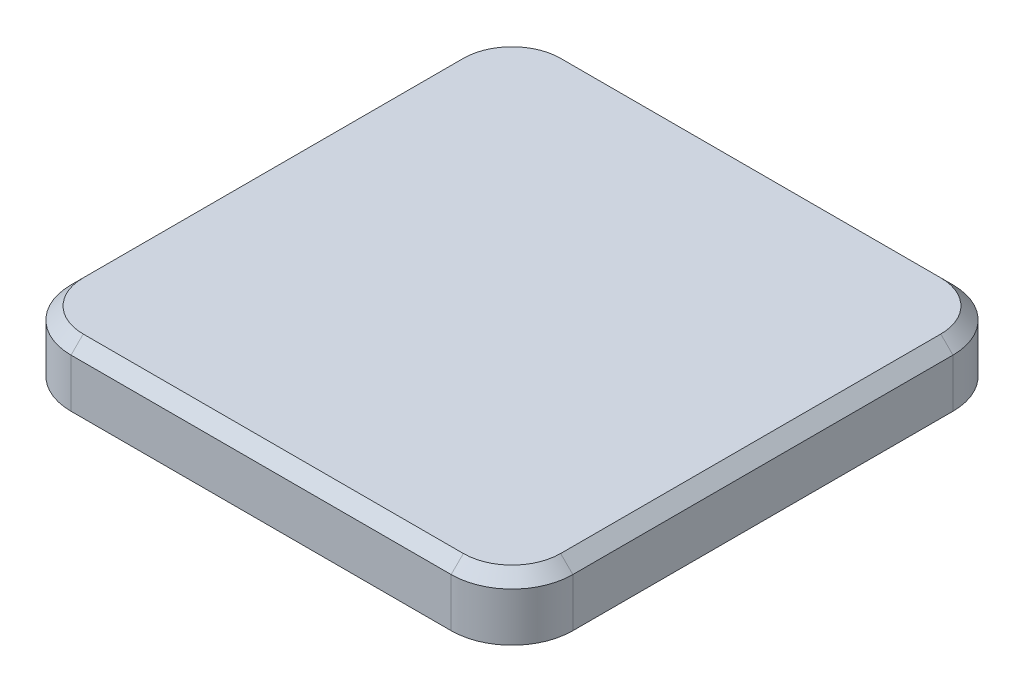
from build123d import *

# Parameters (mm, degrees)
ESQUISSE1_W             = 16.5
ESQUISSE1_H             = 16.5
BOSS_EXTRU_1_DEPTH      = 2
BOSS_EXTRU_2_DEPTH      = 3
BOSS_EXTRU_2_TAPER      = 2
SYM_TRIE2_COPY_1_DEPTH  = 3
SYM_TRIE2_COPY_1_TAPER  = 2
CONG_1_R                = 2
CHANFREIN1_SIZE         = 0.4
ENL_V_MAT_EXTRU_1_DEPTH = 1.6


with BuildPart() as part:
    # Esquisse1 → Boss.-Extru.1 (new body)
    with BuildSketch(Plane(origin=(0, 0, 0), x_dir=(1, 0, 0), z_dir=(0, 1, 0))):
        Rectangle(ESQUISSE1_W, ESQUISSE1_H)
    extrude(amount=BOSS_EXTRU_1_DEPTH)

    # Esquisse2 → Boss.-Extru.2 (add)
    with BuildSketch(Plane.XZ):
        Polygon((-2.35, -0.475899827), (-2.35, 0.5), (-2.25, 0.5), (-2.25, 1.45), (-3.45, 1.45), (-3.45, 0.5), (-3.35, 0.5), (-3.35, -0.475899827), align=None)
    boss_extru_2 = extrude(amount=BOSS_EXTRU_2_DEPTH, taper=BOSS_EXTRU_2_TAPER)

    # Symétrie1: Boss.-Extru.2 across plane
    add(boss_extru_2.mirror(Plane.XY))

    # Symétrie2: Boss.-Extru.2 across plane
    add(boss_extru_2.mirror(Plane(origin=(0, 0, 0), x_dir=(0, 0, 1), z_dir=(1, 0, 0))))

    # Symétrie2 copy 1 sketch → Symétrie2 copy 1 (add)
    with BuildSketch(Plane(origin=(0, 0, 0), x_dir=(-1, 0, 0), z_dir=(0, -1, 0))):
        Polygon((-2.35, -0.475899827), (-2.35, 0.5), (-2.25, 0.5), (-2.25, 1.45), (-3.45, 1.45), (-3.45, 0.5), (-3.35, 0.5), (-3.35, -0.475899827), align=None)
    extrude(amount=SYM_TRIE2_COPY_1_DEPTH, taper=SYM_TRIE2_COPY_1_TAPER)

    # Congé1
    cong_1_edges = [part.edges().sort_by_distance(p)[0] for p in [
        (8.25, 1, 8.25),
        (-8.25, 1, 8.25),
        (-8.25, 1, -8.25),
        (8.25, 1, -8.25),
    ]]
    fillet(cong_1_edges, radius=CONG_1_R)

    # Chanfrein1
    chanfrein1_edges = [part.edges().sort_by_distance(p)[0] for p in [
        (0, 2, -8.25),
        (8.25, 2, 0),
        (-8.25, 2, 0),
        (0, 2, 8.25),
        (-7.664213562, 2, -7.664213562),
        (-7.664213562, 2, 7.664213562),
        (7.664213562, 2, 7.664213562),
        (7.664213562, 2, -7.664213562),
    ]]
    chamfer(chanfrein1_edges, length=CHANFREIN1_SIZE)

    # Esquisse3 → Enlèv. mat.-Extru.1 (cut)
    with BuildSketch(Plane.XZ):
        with BuildLine():
            Line((-1.575, -3.984277344), (-1.575, -3.336914062))
            add(Edge.make_bspline(
                [(-1.575, -3.336914062), (-1.574847832, -3.316392728), (-1.57455992, -3.27756503), (-1.569515207, -3.222565664), (-1.562537162, -3.173985634), (-1.551552538, -3.130998772), (-1.535902623, -3.092325652), (-1.516369987, -3.055832071), (-1.490289613, -3.021967501), (-1.447671651, -2.977887357), (-1.38099065, -2.925629124), (-1.321165156, -2.890253802), (-1.289257813, -2.871386719)],
                knots=[0, 0, 0, 0, 1.051368922, 1.989258278, 2.828359627, 3.564877372, 4.256703728, 4.962292808, 5.679386817, 6.439329514, 8.100951115, 10, 10, 10, 10], degree=3))
            add(Edge.make_bspline(
                [(-1.289257813, -2.871386719), (-1.238731723, -2.845268712), (-1.139605512, -2.794028273), (-0.98915298, -2.728904714), (-0.842017487, -2.673504732), (-0.695860366, -2.629746127), (-0.547782053, -2.596823717), (-0.395107181, -2.572631678), (-0.236085851, -2.559128901), (-0.128084275, -2.557220694), (-0.073144531, -2.55625)],
                knots=[0, 0, 0, 0, 1.074357563, 2.107762432, 3.095394097, 4.043430564, 4.987646856, 5.959471913, 6.961995795, 8, 8, 8, 8], degree=3))
            add(Edge.make_bspline(
                [(-0.073144531, -2.55625), (-0.009272899, -2.557636822), (0.116147249, -2.560360024), (0.299842066, -2.583466715), (0.475007756, -2.620685667), (0.640574117, -2.673588435), (0.796577717, -2.739392847), (0.940554455, -2.82075864), (1.073827814, -2.914410786), (1.193481806, -3.0232777), (1.301327448, -3.14373867), (1.395802068, -3.276972558), (1.476263168, -3.422577787), (1.544188637, -3.579501644), (1.597333733, -3.747409496), (1.635546192, -3.92520751), (1.658377561, -4.112651429), (1.661106079, -4.24078848), (1.6625, -4.30625)],
                knots=[0, 0, 0, 0, 1.1004527, 2.160880131, 3.1853343, 4.18265483, 5.152098474, 6.09807923, 7.027563981, 7.953482777, 8.879701341, 9.809186092, 10.762021988, 11.741783193, 12.751521339, 13.792159158, 14.872077861, 16, 16, 16, 16], degree=3))
            add(Edge.make_bspline(
                [(1.6625, -4.30625), (1.661062633, -4.370799091), (1.658245372, -4.497316343), (1.635890735, -4.683054176), (1.599341105, -4.860449347), (1.54757035, -5.028799263), (1.481150245, -5.186590958), (1.401280818, -5.332904839), (1.30693145, -5.46675119), (1.198464788, -5.5874976), (1.076749384, -5.694928795), (0.943265318, -5.790576855), (0.79605987, -5.870541582), (0.637635702, -5.939111113), (0.466836983, -5.99089966), (0.285359857, -6.029555035), (0.092627918, -6.052124312), (-0.039589232, -6.054852399), (-0.107324219, -6.05625)],
                knots=[0, 0, 0, 0, 1.098577174, 2.153228837, 3.179485586, 4.178212777, 5.146472136, 6.089133441, 7.01037838, 7.92781811, 8.845569396, 9.769057348, 10.716987226, 11.691851712, 12.702842318, 13.749675381, 14.847156307, 16, 16, 16, 16], degree=3))
            add(Edge.make_bspline(
                [(-0.107324219, -6.05625), (-0.162740867, -6.055307935), (-0.270663272, -6.05347329), (-0.427758488, -6.036130678), (-0.575257815, -6.007609407), (-0.712469531, -5.968232536), (-0.837889293, -5.919307337), (-0.952034473, -5.865938991), (-1.053469006, -5.805422169), (-1.142443486, -5.739029567), (-1.219898735, -5.668542457), (-1.286253316, -5.595308782), (-1.344894799, -5.521900738), (-1.390556658, -5.445433551), (-1.426875382, -5.370772902), (-1.453051247, -5.29959708), (-1.47016033, -5.232633722), (-1.472641628, -5.189085454), (-1.473828125, -5.168261719)],
                knots=[0, 0, 0, 0, 1.493526304, 2.908601609, 4.254282934, 5.539376775, 6.750893542, 7.880196463, 8.932637134, 9.929013795, 10.868250492, 11.750880765, 12.591354794, 13.396234964, 14.14629432, 14.82646297, 15.438842792, 16, 16, 16, 16], degree=3))
            add(Edge.make_bspline(
                [(-1.473828125, -5.168261719), (-1.472587377, -5.147412049), (-1.470157478, -5.106579734), (-1.452620603, -5.047596536), (-1.422328102, -4.994058884), (-1.381436264, -4.946759035), (-1.332614869, -4.90721984), (-1.277949295, -4.878026082), (-1.218151753, -4.859924208), (-1.176594009, -4.858141271), (-1.155273438, -4.857226563)],
                knots=[0, 0, 0, 0, 1.011347772, 1.98063909, 2.956031586, 3.97569046, 4.998224318, 5.987747808, 6.967644449, 8, 8, 8, 8], degree=3))
            add(Edge.make_bspline(
                [(-1.155273438, -4.857226563), (-1.131289132, -4.85890009), (-1.082955403, -4.862272622), (-1.015026719, -4.891164211), (-0.951991459, -4.931816634), (-0.920343402, -4.970854445), (-0.904394531, -4.990527344)],
                knots=[0, 0, 0, 0, 0.974082092, 1.962992855, 2.973461023, 4, 4, 4, 4], degree=3))
            add(Edge.make_bspline(
                [(-0.904394531, -4.990527344), (-0.884116918, -5.021899027), (-0.845992584, -5.080881538), (-0.788684033, -5.161897896), (-0.737322236, -5.231242973), (-0.689753628, -5.291022988), (-0.639431466, -5.341329009), (-0.58328082, -5.386253896), (-0.519470834, -5.426948968), (-0.4480701, -5.464709135), (-0.366794074, -5.494634077), (-0.275544199, -5.516451851), (-0.173999009, -5.529297297), (-0.102805503, -5.530580075), (-0.065625, -5.53125)],
                knots=[0, 0, 0, 0, 1.269947272, 2.387652494, 3.37313563, 4.204428757, 4.982345797, 5.786964542, 6.644417406, 7.552294032, 8.527983303, 9.580271219, 10.73630703, 12, 12, 12, 12], degree=3))
            add(Edge.make_bspline(
                [(-0.065625, -5.53125), (-0.02661868, -5.530110629), (0.049639447, -5.527883135), (0.160899679, -5.513105852), (0.265420194, -5.486686174), (0.363828072, -5.45147555), (0.455244924, -5.405282194), (0.53974101, -5.349592426), (0.617406976, -5.284887154), (0.688434076, -5.211398491), (0.751312195, -5.128076186), (0.806782554, -5.036234517), (0.854175941, -4.935362919), (0.893379303, -4.826129071), (0.925061924, -4.709388867), (0.946108446, -4.585973475), (0.960713876, -4.456762802), (0.961895439, -4.368500383), (0.9625, -4.323339844)],
                knots=[0, 0, 0, 0, 1.044410732, 2.041843643, 2.997734968, 3.926068631, 4.83464545, 5.733170603, 6.629933431, 7.536048868, 8.463419736, 9.418707305, 10.40391836, 11.442234805, 12.522592864, 13.637990383, 14.791449055, 16, 16, 16, 16], degree=3))
            add(Edge.make_bspline(
                [(0.9625, -4.323339844), (0.961801211, -4.275003267), (0.960440484, -4.18087917), (0.947358426, -4.044002287), (0.925573834, -3.915835559), (0.895763361, -3.796078936), (0.856795995, -3.685101046), (0.809536801, -3.582345542), (0.753493274, -3.488109518), (0.688115615, -3.40319437), (0.615780369, -3.326963), (0.535926289, -3.260853419), (0.449191479, -3.205028262), (0.355378121, -3.15986487), (0.255266351, -3.12417699), (0.148233458, -3.0989371), (0.034396363, -3.083676281), (-0.043929082, -3.082072279), (-0.084082031, -3.08125)],
                knots=[0, 0, 0, 0, 1.258228293, 2.450103211, 3.575637537, 4.640414304, 5.659261833, 6.633411695, 7.580652055, 8.50738272, 9.417945118, 10.311239573, 11.199892376, 12.096725889, 13.01619305, 13.961592355, 14.955025684, 16, 16, 16, 16], degree=3))
            add(Edge.make_bspline(
                [(-0.084082031, -3.08125), (-0.123534552, -3.082049073), (-0.201245111, -3.083623025), (-0.316097263, -3.0957804), (-0.427527103, -3.114306818), (-0.535742852, -3.142506903), (-0.64230754, -3.176826185), (-0.748709463, -3.218325548), (-0.855941905, -3.265995482), (-0.926659313, -3.302172655), (-0.9625, -3.320507812)],
                knots=[0, 0, 0, 0, 1.02885752, 2.026564883, 3.009558228, 3.972509867, 4.940510834, 5.928379564, 6.950070379, 8, 8, 8, 8], degree=3))
            Line((-0.9625, -3.320507812), (-0.9625, -3.86875))
            Line((-0.9625, -3.86875), (-0.4265625, -3.86875))
            add(Edge.make_bspline(
                [(-0.4265625, -3.86875), (-0.396223406, -3.869272239), (-0.339191478, -3.870253953), (-0.259481399, -3.880834197), (-0.191452565, -3.898986694), (-0.134355997, -3.924372309), (-0.089305761, -3.960397014), (-0.0562391, -4.006666187), (-0.03784857, -4.06433654), (-0.035897861, -4.105827068), (-0.034863281, -4.127832031)],
                knots=[0, 0, 0, 0, 1.358443562, 2.553624567, 3.591144608, 4.504340498, 5.331646099, 6.14440579, 7.015864959, 8, 8, 8, 8], degree=3))
            add(Edge.make_bspline(
                [(-0.034863281, -4.127832031), (-0.035568953, -4.146429669), (-0.036938944, -4.182535112), (-0.053842682, -4.233596499), (-0.079415174, -4.280119216), (-0.115999806, -4.32007034), (-0.160572982, -4.353360663), (-0.2135794, -4.376803568), (-0.273574554, -4.39133497), (-0.316187708, -4.392923012), (-0.338378906, -4.39375)],
                knots=[0, 0, 0, 0, 0.981443865, 1.90537461, 2.818756677, 3.776149258, 4.751561202, 5.745618933, 6.826010021, 8, 8, 8, 8], degree=3))
            Line((-0.338378906, -4.39375), (-1.112890625, -4.39375))
            add(Edge.make_bspline(
                [(-1.112890625, -4.39375), (-1.135695154, -4.39366157), (-1.179781962, -4.393490612), (-1.242892872, -4.387322155), (-1.301061563, -4.380485226), (-1.353940674, -4.369131518), (-1.402205908, -4.35245571), (-1.445082276, -4.327022561), (-1.482786214, -4.293697418), (-1.516738508, -4.252575909), (-1.543477634, -4.200776693), (-1.562328275, -4.138302648), (-1.57266557, -4.064824588), (-1.574186756, -4.012337544), (-1.575, -3.984277344)],
                knots=[0, 0, 0, 0, 1.133944679, 2.192196156, 3.15265, 4.046635315, 4.87866381, 5.681685132, 6.509299241, 7.371595909, 8.319929126, 9.388514686, 10.603868798, 12, 12, 12, 12], degree=3))
        make_face()
    extrude(amount=-ENL_V_MAT_EXTRU_1_DEPTH, mode=Mode.SUBTRACT)


solid = part.part
